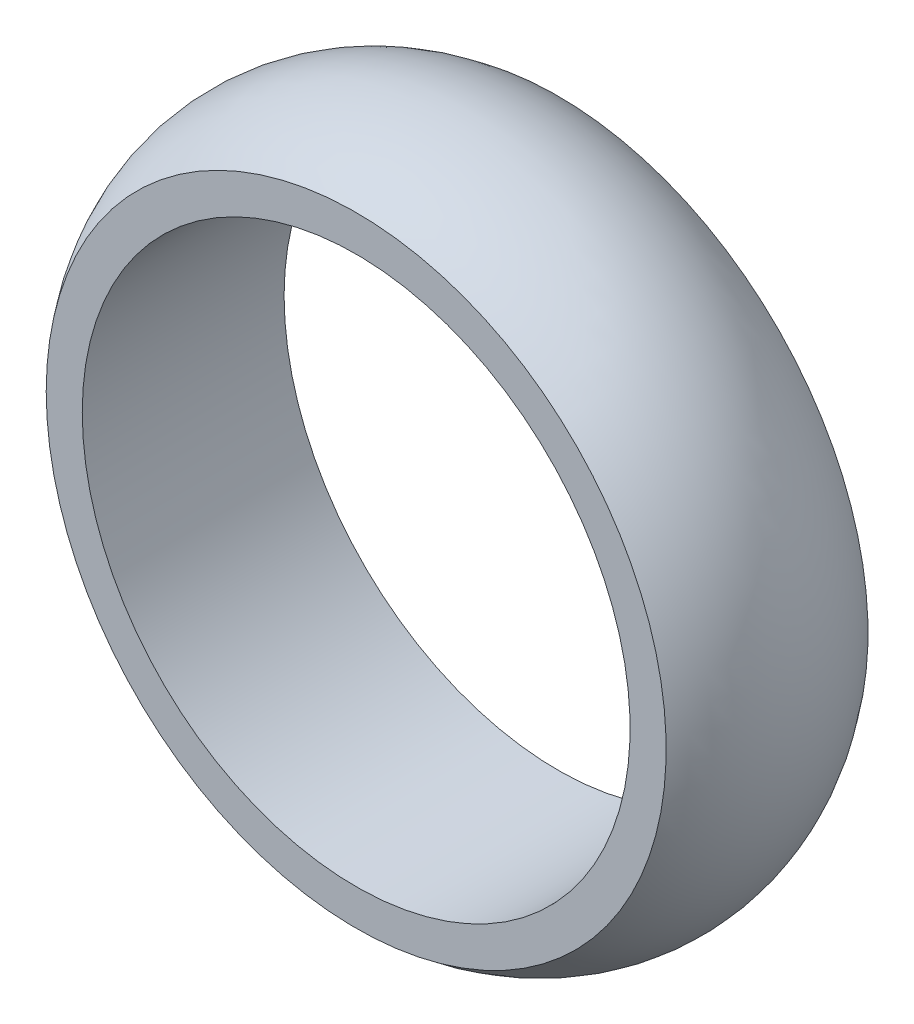
from build123d import *


with BuildPart() as part:
    # Sketch1 → Revolve1 (revolve)
    with BuildSketch(Plane(origin=(0, 0, 0), x_dir=(1, 0, 0), z_dir=(0, 1, 0))):
        with BuildLine():
            Line((-9.5, 3.5), (-10.75, 3.5))
            ThreePointArc((-10.75, 3.5), (-12, 0), (-10.75, -3.5))
            Line((-10.75, -3.5), (-9.5, -3.5))
            Line((-9.5, -3.5), (-9.5, 3.5))
        make_face()
    revolve(axis=Axis((0, 0, -8.708137), (0, 0, 1)))


solid = part.part
